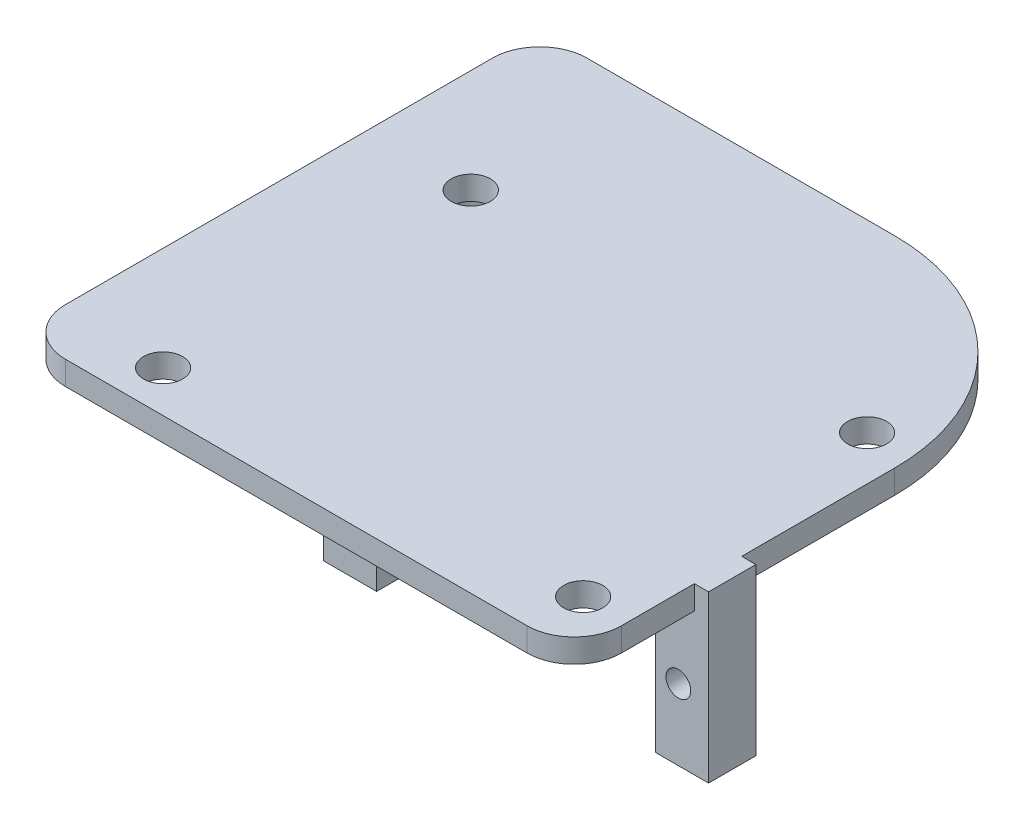
from build123d import *
from build123d.topology import SkipClean

# Parameters (mm, degrees)
SKETCH1_W           = 41.99999943
SKETCH1_H           = 32.99999982
BOSS_EXTRUDE1_DEPTH = 2
FILLET1_R           = 4
SKETCH3_R           = 1.65
CUT_EXTRUDE1_DEPTH  = 2
SKETCH5_W           = 41.99999943
SKETCH5_H           = 16
BOSS_EXTRUDE3_DEPTH = 2
SKETCH6_R           = 1.65
SKETCH6_R_2         = 1.656480043
CUT_EXTRUDE2_DEPTH  = 2
FILLET2_R           = 17
FILLET3_R           = 4
SKETCH7_W           = 9
SKETCH7_H           = 44.079753615
BOSS_EXTRUDE4_DEPTH = 2
CUT_EXTRUDE3_DEPTH  = 2
FILLET4_R           = 4
SKETCH9_R           = 1
BOSS_EXTRUDE5_DEPTH = 10
SKETCH10_W          = 1.2
SKETCH10_H          = 2
BOSS_EXTRUDE6_DEPTH = 2
SKETCH11_W          = 4.5
SKETCH11_H          = 2
BOSS_EXTRUDE7_DEPTH = 12
CUT_EXTRUDE4_DEPTH  = 10
SKETCH13_W          = 2
SKETCH13_H          = 4.75
CUT_EXTRUDE5_DEPTH  = 2
BOSS_EXTRUDE8_START = 2
SKETCH15_W          = 4.5
SKETCH15_H          = 12
SKETCH15_R          = 1.05
BOSS_EXTRUDE8_DEPTH = 2


with BuildPart() as part:
    # Sketch1 → Boss-Extrude1 (new body)
    with BuildSketch(Plane(origin=(0, 0, 0), x_dir=(1, 0, 0), z_dir=(0, 1, 0))):
        with Locations((20.999999715, 16.49999991)):
            Rectangle(SKETCH1_W, SKETCH1_H)
    extrude(amount=BOSS_EXTRUDE1_DEPTH)

    # Fillet1
    fillet1_edges = [part.edges().sort_by_distance(p)[0] for p in [
        (0, 1, -32.99999982),
        (41.99999943, 1, -32.99999982),
        (41.99999943, 1, 0),
        (0, 1, 0),
    ]]
    fillet(fillet1_edges, radius=FILLET1_R)

    # Sketch3 → Cut-Extrude1 (cut)
    with BuildSketch(Plane.XZ):
        with Locations(Location((3.75, -3.5, 0), (0, 0, 270))):
            Circle(SKETCH3_R)
        with Locations(Location((3.75, -29.499999821, 0), (0, 0, 270))):
            Circle(SKETCH3_R)
        with Locations(Location((38.249999434, -28.499999821, 0), (0, 0, 270))):
            Circle(SKETCH3_R)
        with Locations(Location((38.249999434, -4.5, 0), (0, 0, 270))):
            Circle(SKETCH3_R)
    extrude(amount=-CUT_EXTRUDE1_DEPTH, mode=Mode.SUBTRACT)

    # Sketch5 → Boss-Extrude3 (add)
    with BuildSketch(Plane.XZ):
        with Locations((20.999999715, -36.079753615)):
            Rectangle(SKETCH5_W, SKETCH5_H)
    extrude(amount=-BOSS_EXTRUDE3_DEPTH)

    # Sketch6 → Cut-Extrude2 (cut)
    with BuildSketch(Plane.XZ):
        with Locations(Location((38.249999434, -28.499999821, 0), (0, 0, 270))):
            Circle(SKETCH6_R)
        with Locations(Location((3.747696905, -29.506056777, 0), (0, 0, 270))):
            Circle(SKETCH6_R_2)
    extrude(amount=-CUT_EXTRUDE2_DEPTH, mode=Mode.SUBTRACT)

    # Fillet2
    fillet2_edges = [part.edges().sort_by_distance(p)[0] for p in [
        (41.99999943, 1, -44.079753615),
    ]]
    fillet(fillet2_edges, radius=FILLET2_R)

    # Fillet3
    fillet3_edges = [part.edges().sort_by_distance(p)[0] for p in [
        (0, 1, -44.079753615),
    ]]
    fillet(fillet3_edges, radius=FILLET3_R)

    # Sketch7 → Boss-Extrude4 (add)
    with BuildSketch(Plane.XZ):
        with Locations((-0.5, -22.039876808)):
            Rectangle(SKETCH7_W, SKETCH7_H)
    extrude(amount=-BOSS_EXTRUDE4_DEPTH)

    # Sketch8 → Cut-Extrude3 (cut)
    with SkipClean():  # the faces are left unmerged after this step: merging them gives an invalid solid
        with BuildSketch(Plane.XZ):
            with BuildLine():
                ThreePointArc((4, -5.130950643), (5.001998403, -4.574709263), (5.4, -3.5))
                ThreePointArc((5.4, -3.5), (5.001998403, -2.425290737), (4, -1.869049357))
                Line((4, -1.869049357), (4, -5.130950643))
            make_face()
            with BuildLine():
                Line((4, -5.130950643), (4, -1.869049357))
                ThreePointArc((4, -1.869049357), (2.1, -3.5), (4, -5.130950643))
            make_face()
            with BuildLine():
                ThreePointArc((4, -1.869049357), (5.4, -3.5), (4, -5.130950643))
                Line((4, -5.130950643), (4, -1.869049357))
            make_face()
            with BuildLine():
                ThreePointArc((4, -27.86890398), (5.404176948, -29.506056777), (4, -31.143209574))
                Line((4, -31.143209574), (4, -27.86890398))
            make_face()
            with BuildLine():
                ThreePointArc((5.404176948, -29.506056777), (5.402815419, -29.43890888), (5.398733067, -29.371871366))
                ThreePointArc((5.398733067, -29.371871366), (4.96029858, -28.377551876), (4, -27.86890398))
                Line((4, -27.86890398), (4, -31.143209574))
                ThreePointArc((4, -31.143209574), (5.005047527, -30.584479489), (5.404176948, -29.506056777))
            make_face()
            with BuildLine():
                Line((4, -31.143209574), (4, -27.86890398))
                ThreePointArc((4, -27.86890398), (2.091216862, -29.506056777), (4, -31.143209574))
            make_face()
        extrude(amount=-CUT_EXTRUDE3_DEPTH, mode=Mode.SUBTRACT)

    # Fillet4
    fillet4_edges = [part.edges().sort_by_distance(p)[0] for p in [
        (-5, 1, -44.079753615),
        (-5, 1, 0),
    ]]
    fillet(fillet4_edges, radius=FILLET4_R)

    # Sketch9 → Boss-Extrude5 (add)
    with BuildSketch(Plane.XZ):
        with BuildLine():
            Line((19.99999943, -38.62499991), (19.99999943, -28.49999991))
            Line((19.99999943, -28.49999991), (6.573975303, -28.49999991))
            ThreePointArc((6.573975303, -28.49999991), (6.703947503, -28.995584051), (6.747696905, -29.506056777))
            ThreePointArc((6.747696905, -29.506056777), (4.543595006, -32.398555042), (1.16999943, -31.040812694))
            Line((1.16999943, -31.040812694), (1.16999943, -43.74999991))
            Line((1.16999943, -43.74999991), (19.99999943, -43.74999991))
            Line((19.99999943, -43.74999991), (19.99999943, -38.62499991))
        make_face()
        with Locations(Location((17.99999943, -41.74999991, 0), (0, 0, 270))):
            Circle(SKETCH9_R, mode=Mode.SUBTRACT)
        with Locations(Location((17.99999943, -30.49999991, 0), (0, 0, 270))):
            Circle(SKETCH9_R, mode=Mode.SUBTRACT)
    extrude(amount=BOSS_EXTRUDE5_DEPTH)

    # Sketch10 → Boss-Extrude6 (add)
    with BuildSketch(Plane(origin=(0, 2, 0), x_dir=(1, 0, 0), z_dir=(0, 1, 0))):
        with Locations((42.59999943, 13.15)):
            Rectangle(SKETCH10_W, SKETCH10_H)
    extrude(amount=-BOSS_EXTRUDE6_DEPTH)

    # Sketch11 → Boss-Extrude7 (add)
    with BuildSketch(Plane.XZ):
        with Locations((40.94999943, -13.15)):
            Rectangle(SKETCH11_W, SKETCH11_H)
        with Locations((12.894917885, -13.15)):
            Rectangle(SKETCH11_W, SKETCH11_H)
    extrude(amount=BOSS_EXTRUDE7_DEPTH)

    # Sketch12 → Cut-Extrude4 (cut)
    with BuildSketch(Plane.XY.offset(-12.15)):
        with BuildLine():
            ThreePointArc((41.694917885, -6), (41.66275253, -5.742099563), (41.568227151, -5.5))
            ThreePointArc((41.568227151, -5.5), (39.594917885, -6), (41.568227151, -6.5))
            ThreePointArc((41.568227151, -6.5), (41.66275253, -6.257900437), (41.694917885, -6))
        make_face()
        with BuildLine():
            ThreePointArc((12.221608619, -5.5), (12.094917885, -6), (12.221608619, -6.5))
            ThreePointArc((12.221608619, -6.5), (13.402818322, -7.017834645), (14.194917885, -6))
            ThreePointArc((14.194917885, -6), (13.402818322, -4.982165355), (12.221608619, -5.5))
        make_face()
    extrude(amount=-CUT_EXTRUDE4_DEPTH, mode=Mode.SUBTRACT)

    # Sketch13 → Cut-Extrude5 (cut)
    with BuildSketch(Plane(origin=(19.99999943, 0, 0), x_dir=(0, 0, -1), z_dir=(1, 0, 0))):
        with Locations((29.49999991, -6.125)):
            Rectangle(SKETCH13_W, SKETCH13_H)
    extrude(amount=-CUT_EXTRUDE5_DEPTH, mode=Mode.SUBTRACT)

    # Sketch15 → Boss-Extrude8 (add)
    # profile 1 of 2: a face of its own
    with BuildSketch(Plane.XY.offset(-12.15).offset(BOSS_EXTRUDE8_START)):
        with Locations((12.894917885, -6)):
            Rectangle(SKETCH15_W, SKETCH15_H)
        with Locations((13.144917885, -6)):
            Circle(SKETCH15_R, mode=Mode.SUBTRACT)
    # profile 2 of 2: a face of its own
    with BuildSketch(Plane.XY.offset(-12.15).offset(BOSS_EXTRUDE8_START)):
        Polygon((41.99999943, 2), (41.99999943, 0), (38.69999943, 0), (38.69999943, -12), (43.19999943, -12), (43.19999943, 2), align=None)
        with Locations((40.644917885, -6)):
            Circle(SKETCH15_R, mode=Mode.SUBTRACT)
    extrude(amount=-BOSS_EXTRUDE8_DEPTH)


solid = part.part
